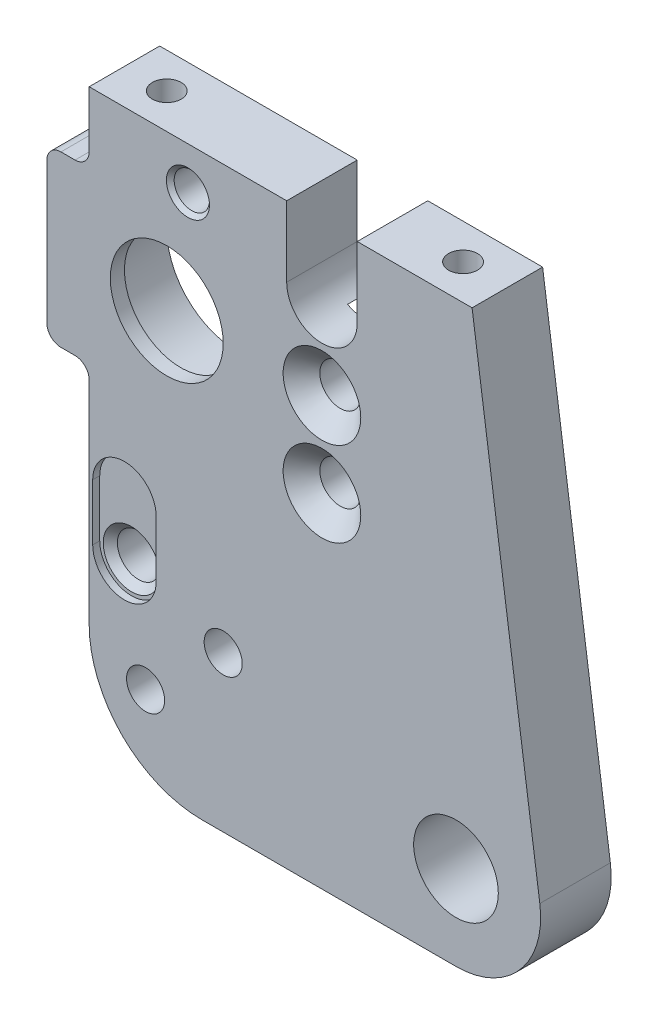
from build123d import *

# Parameters (mm, degrees)
SKETCH_1_W                                           = 34
SKETCH_1_H                                           = 41
EXTRUDE_1_DEPTH                                      = 5
FILLET_1_R                                           = 8
SKETCH_2_R                                           = 3
CUT_EXTRUDE_2_DEPTH                                  = 5
SKETCH_3_R                                           = 4
CUT_EXTRUDE_3_DEPTH                                  = 5
SKETCH_4_R                                           = 5
CUT_EXTRUDE_4_DEPTH                                  = 4
HOLE_WIZARD_M2_5_1_D                                 = 2.05
HOLE_WIZARD_M2_5_1_DEPTH                             = 7.35
HOLE_WIZARD_M2_5_1_TIP                               = 0.615882135
CUT_EXTRUDE_5_DEPTH                                  = 10
EXTRUDE1_START                                       = -5
EXTRUDE1_DEPTH                                       = 5
SKETCH_8_R                                           = 1.5
CUT_EXTRUDE_6_DEPTH                                  = 4.5
SKETCH9_R                                            = 0.5
EXTRUDE5_DEPTH                                       = 53.203927134
CUT_EXTRUDE_7_DEPTH                                  = 0.5
CHAMFER_3_SIZE                                       = 0.5
SKETCH2_W                                            = 6
SKETCH2_H                                            = 12
EXTRUDE2_DEPTH                                       = 2
SKETCH7_R                                            = 1.5
EXTRUDE3_DEPTH                                       = 2
EXTRUDE4_DEPTH                                       = 53.249401989
SKETCH10_R                                           = 1.5
EXTRUDE6_DEPTH                                       = 10
CBORE_FOR_M2_5_HEXAGON_SOCKET_HEAD_CAP_S_D           = 2.7
CBORE_FOR_M2_5_HEXAGON_SOCKET_HEAD_CAP_S_CBORE_D     = 5
CBORE_FOR_M2_5_HEXAGON_SOCKET_HEAD_CAP_S_CBORE_DEPTH = 2.5
HOLE_WIZARD_M2_5_1_2_D                               = 2.9
HOLE_WIZARD_M2_5_1_2_CSINK_D                         = 5.5
HOLE_WIZARD_M2_5_1_2_CSINK_ANGLE                     = 90
SKETCH_21_W                                          = 5
SKETCH_21_H                                          = 12
EXTRUDE_1_2_DEPTH                                    = 3
FILLET_2_R                                           = 1
M3X0_5_1_D                                           = 2.5
M3X0_5_1_CSINK_D                                     = 3.05
M3X0_5_1_CSINK_ANGLE                                 = 90


with BuildPart() as part:
    # 草图1 → Extrude 1 (new body)
    with BuildSketch(Plane.XY):
        with Locations((17, 20.5)):
            Rectangle(SKETCH_1_W, SKETCH_1_H)
    extrude(amount=EXTRUDE_1_DEPTH)

    # 圆角1
    fillet_1_edges = [part.edges().sort_by_distance(p)[0] for p in [
        (0, 0, 2.5),
    ]]
    fillet(fillet_1_edges, radius=FILLET_1_R)

    # 草图2 → 拉伸2 (cut)
    with BuildSketch(Plane.XY.offset(5)):
        with Locations((26, 6)):
            Circle(SKETCH_2_R)
    extrude(amount=-CUT_EXTRUDE_2_DEPTH, mode=Mode.SUBTRACT)

    # 草图3 → 拉伸3 (cut)
    with BuildSketch(Plane(origin=(0, 0, 0), x_dir=(-1, 0, 0), z_dir=(0, 0, -1))):
        with Locations((-5.5, 30)):
            Circle(SKETCH_3_R)
    extrude(amount=-CUT_EXTRUDE_3_DEPTH, mode=Mode.SUBTRACT)

    # 草图4 → 拉伸4 (cut)
    with BuildSketch(Plane(origin=(0, 0, 0), x_dir=(-1, 0, 0), z_dir=(0, 0, -1))):
        with Locations((-5.5, 30)):
            Circle(SKETCH_4_R)
    extrude(amount=-CUT_EXTRUDE_4_DEPTH, mode=Mode.SUBTRACT)

    # Hole Wizard M2.5 _1
    with Locations(Plane(origin=(3, 41, 2.5), x_dir=(0, 0, 1), z_dir=(0, 1, 0))):
        with Locations((0, 0), (0, 21)):
            Hole(HOLE_WIZARD_M2_5_1_D / 2, depth=HOLE_WIZARD_M2_5_1_DEPTH)
            with Locations((0, 0, -(HOLE_WIZARD_M2_5_1_DEPTH + HOLE_WIZARD_M2_5_1_TIP / 2))):  # 118° drill point
                Cone(0, HOLE_WIZARD_M2_5_1_D / 2, HOLE_WIZARD_M2_5_1_TIP, mode=Mode.SUBTRACT)

    # 草图7 → 拉伸5 (cut)
    with BuildSketch(Plane(origin=(0, 0, 0), x_dir=(-1, 0, 0), z_dir=(0, 0, -1))):
        with BuildLine():
            Line((-26, 0), (-34, 0))
            Line((-34, 0), (-34, 41))
            Line((-34, 41), (-27.140036221, 41))
            Line((-27.140036221, 41), (-31.941608412, 6.835038606))
            ThreePointArc((-31.941608412, 6.835038606), (-30.528257481, 2.063645826), (-26, 0))
        make_face()
    extrude(amount=-CUT_EXTRUDE_5_DEPTH, mode=Mode.SUBTRACT)

    # Sketch1 → Extrude1 (add)
    with BuildSketch(Plane.XY.offset(5).offset(EXTRUDE1_START)):
        with BuildLine():
            Line((26, 0), (12, 0))
            ThreePointArc((12, 0), (3.514718626, 3.514718626), (0, 12))
            Line((0, 12), (0, 12.980209143))
            Line((0, 12.980209143), (29.441458618, 1.085087734))
            ThreePointArc((29.441458618, 1.085087734), (27.804234797, 0.277698296), (26, 0))
        make_face()
    extrude(amount=EXTRUDE1_DEPTH)

    # 草图8 → 拉伸6 (cut)
    with BuildSketch(Plane.XY.offset(5)):
        with Locations((2.5, 13)):
            Circle(SKETCH_8_R)
    extrude(amount=-CUT_EXTRUDE_6_DEPTH, mode=Mode.SUBTRACT)

    # Sketch9 → Extrude5 (cut, through all)
    with BuildSketch(Plane.XY.offset(0.5)):
        with Locations((1.5, 13)):
            Circle(SKETCH9_R)
    extrude(amount=-EXTRUDE5_DEPTH, mode=Mode.SUBTRACT)

    # 草图9 → 拉伸7 (cut)
    with BuildSketch(Plane.XY.offset(5)):
        with BuildLine():
            Line((0.25, 13), (0.25, 17))
            ThreePointArc((0.25, 17), (2.5, 19.25), (4.75, 17))
            Line((4.75, 17), (4.75, 13))
            ThreePointArc((4.75, 13), (2.5, 10.75), (0.25, 13))
        make_face()
    extrude(amount=-CUT_EXTRUDE_7_DEPTH, mode=Mode.SUBTRACT)

    # 倒角3
    chamfer_3_edges = [part.edges().sort_by_distance(p)[0] for p in [
        (1, 13, 4.5),
    ]]
    chamfer(chamfer_3_edges, length=CHAMFER_3_SIZE)

    # Sketch2 → Extrude2 (cut)
    with BuildSketch(Plane(origin=(0, 0, 0), x_dir=(-1, 0, 0), z_dir=(0, 0, -1))):
        with Locations((-16.5, 27.8)):
            Rectangle(SKETCH2_W, SKETCH2_H)
    extrude(amount=-EXTRUDE2_DEPTH, mode=Mode.SUBTRACT)

    # Sketch7 → Extrude3 (cut)
    with BuildSketch(Plane(origin=(0, 0, 0), x_dir=(-1, 0, 0), z_dir=(0, 0, -1))):
        with Locations((-19.5, 32.3)):
            Circle(SKETCH7_R)
        with Locations((-13.5, 32.3)):
            Circle(SKETCH7_R)
        with Locations((-19.5, 23.3)):
            Circle(SKETCH7_R)
        with Locations((-13.5, 23.3)):
            Circle(SKETCH7_R)
    extrude(amount=-EXTRUDE3_DEPTH, mode=Mode.SUBTRACT)

    # Sketch8 → Extrude4 (cut, through all)
    with BuildSketch(Plane(origin=(0, 0, 0), x_dir=(-1, 0, 0), z_dir=(0, 0, -1))):
        with BuildLine():
            Line((-14, 36), (-14, 41))
            Line((-14, 41), (-19, 41))
            Line((-19, 41), (-19, 36))
            ThreePointArc((-19, 36), (-16.5, 33.5), (-14, 36))
        make_face()
    extrude(amount=-EXTRUDE4_DEPTH, mode=Mode.SUBTRACT)

    # Sketch10 → Extrude6 (cut)
    with BuildSketch(Plane.XY.offset(4.5)):
        with Locations((2.5, 13)):
            Circle(SKETCH10_R)
    extrude(amount=-EXTRUDE6_DEPTH, mode=Mode.SUBTRACT)

    # CBORE for M2.5 Hexagon socket head cap screws1 (through all)
    with Locations(Plane(origin=(4, 6, 0), x_dir=(-1, 0, 0), z_dir=(0, 0, -1))):
        with Locations((0, 0), (-5.5, 5)):
            CounterBoreHole(CBORE_FOR_M2_5_HEXAGON_SOCKET_HEAD_CAP_S_D / 2, CBORE_FOR_M2_5_HEXAGON_SOCKET_HEAD_CAP_S_CBORE_D / 2, CBORE_FOR_M2_5_HEXAGON_SOCKET_HEAD_CAP_S_CBORE_DEPTH)

    # Hole Wizard M2.5 _1 2 (through all)
    with Locations(Plane(origin=(16.5, 30.3, 5), x_dir=(1, 0, 0), z_dir=(0, 0, 1))):
        with Locations((0, 0), (0, -6)):
            CounterSinkHole(HOLE_WIZARD_M2_5_1_2_D / 2, HOLE_WIZARD_M2_5_1_2_CSINK_D / 2, counter_sink_angle=HOLE_WIZARD_M2_5_1_2_CSINK_ANGLE)

    # 草图21 → Extrude 1 2 (add)
    with BuildSketch(Plane.ZY):
        with Locations((2.5, 30)):
            Rectangle(SKETCH_21_W, SKETCH_21_H)
    extrude(amount=EXTRUDE_1_2_DEPTH)

    # 圆角2
    fillet_2_edges = [part.edges().sort_by_distance(p)[0] for p in [
        (0, 24, 2.5),
        (-3, 36, 2.5),
        (-3, 24, 2.5),
        (0, 36, 2.5),
    ]]
    fillet(fillet_2_edges, radius=FILLET_2_R)

    # M3x0.5 螺纹孔1 (through all)
    with Locations(Plane(origin=(7, 38, 5), x_dir=(1, 0, 0), z_dir=(0, 0, 1))):
        with Locations((0, 0)):
            CounterSinkHole(M3X0_5_1_D / 2, M3X0_5_1_CSINK_D / 2, counter_sink_angle=M3X0_5_1_CSINK_ANGLE)


solid = part.part
